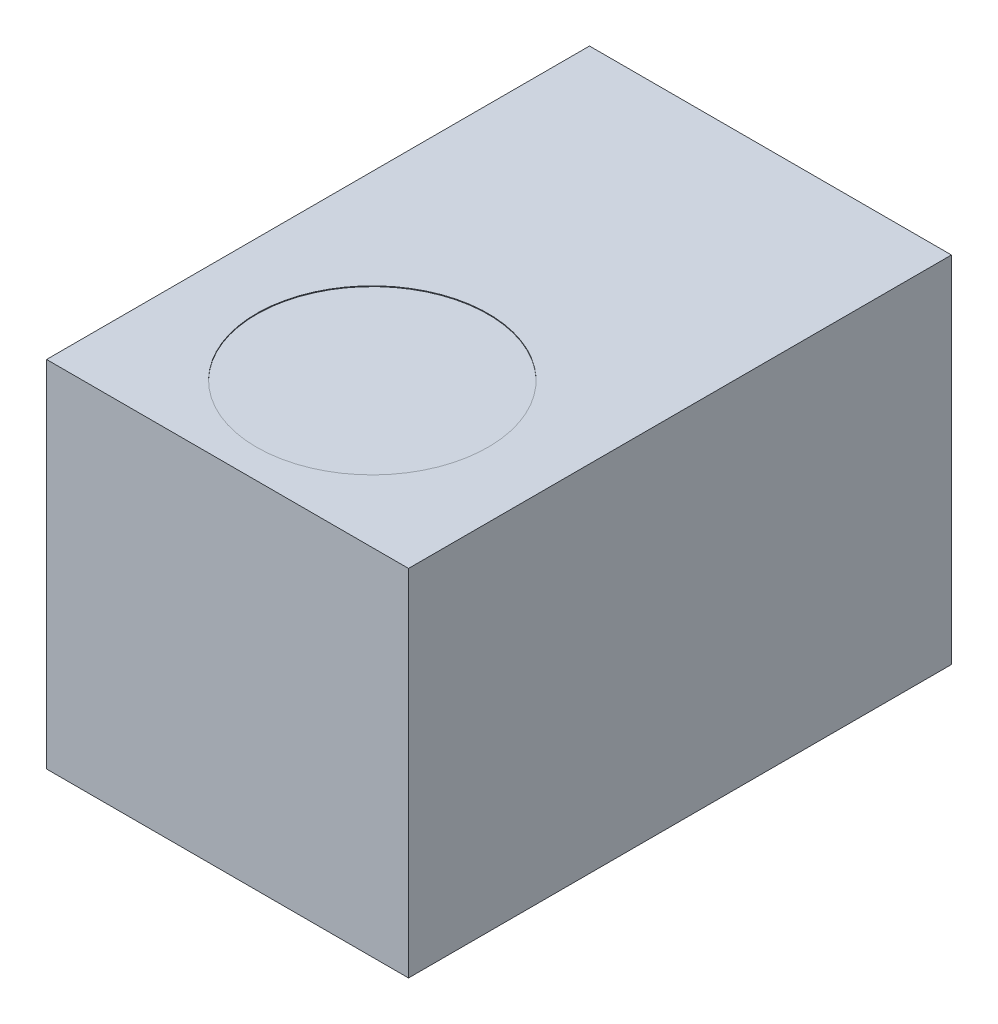
from build123d import *

# Parameters (mm, degrees)
SKETCH1_W           = 75
SKETCH1_H           = 49
BOSS_EXTRUDE1_DEPTH = 50
SKETCH2_W           = 40
SKETCH2_H           = 52
CUT_EXTRUDE1_DEPTH  = 40
SKETCH3_R           = 16
CUT_EXTRUDE3_DEPTH  = 0.1


with BuildPart() as part:
    # Sketch1 → Boss-Extrude1 (new body)
    with BuildSketch(Plane(origin=(0, 0, 0), x_dir=(0, 0, -1), z_dir=(1, 0, 0))):
        Rectangle(SKETCH1_W, SKETCH1_H)
    extrude(amount=BOSS_EXTRUDE1_DEPTH)

    # Sketch2 → Cut-Extrude1 (cut)
    with BuildSketch(Plane.XZ.offset(24.5)):
        with Locations((25, 9.5)):
            Rectangle(SKETCH2_W, SKETCH2_H)
    extrude(amount=-CUT_EXTRUDE1_DEPTH, mode=Mode.SUBTRACT)

    # Sketch3 → Cut-Extrude3 (cut)
    with BuildSketch(Plane(origin=(0, 24.5, 0), x_dir=(1, 0, 0), z_dir=(0, 1, 0))):
        with Locations(Location((25, -17.5, 0), (0, 0, 270))):
            Circle(SKETCH3_R)
    extrude(amount=-CUT_EXTRUDE3_DEPTH, mode=Mode.SUBTRACT)


solid = part.part
